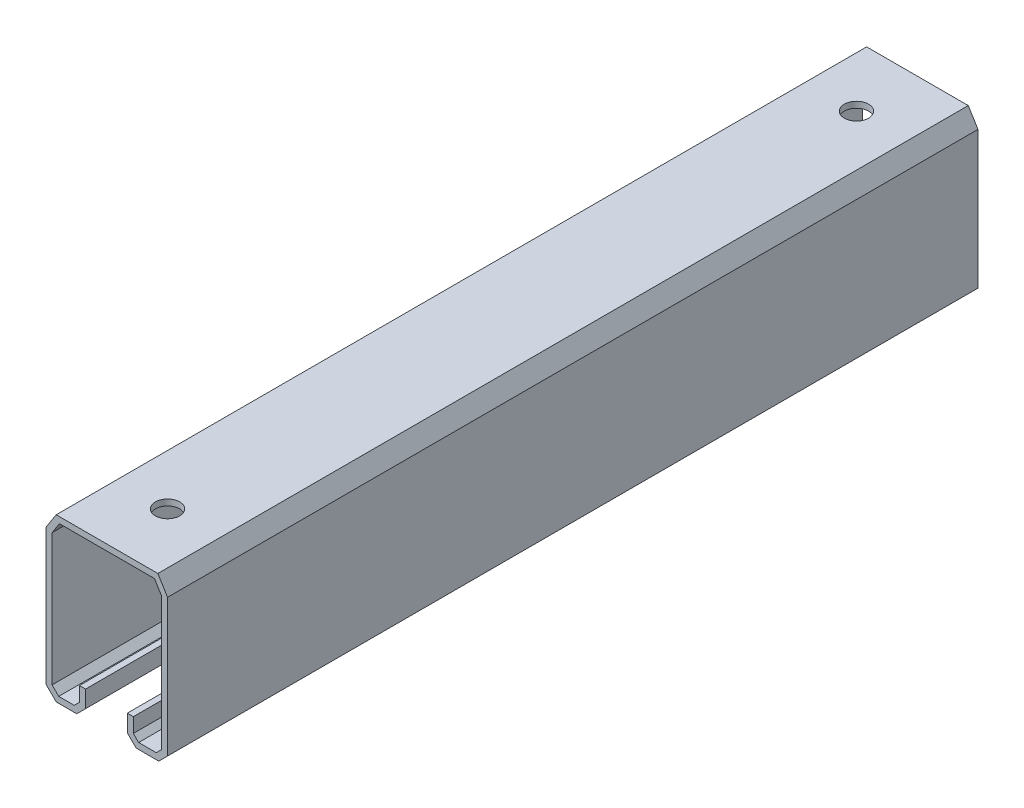
from build123d import *

# Parameters (mm, degrees)
SALIENTE_EXTRUIR1_DEPTH = 200
CROQUIS2_R              = 6
CORTAR_EXTRUIR1_DEPTH   = 400


with BuildPart() as part:
    # Croquis1 → Saliente-Extruir1 (new, symmetric)
    with BuildSketch(Plane.XY):
        Polygon((-10.469747898, -27.240151607), (-10.469747898, -35.650909673), (-14.818838224, -40), (-24.971054909, -40), (-30, -34.971054909), (-30, 32.215207139), (-24.971054909, 40), (25.20346735, 40), (30, 32.215207139), (30, -35.650909673), (25.650909673, -40), (14.472500162, -40), (10.123409835, -35.650909673), (10.123409835, -27.240151607), (13.123409835, -27.240151607), (13.123409835, -34.408268986), (15.715140849, -37), (24.408268986, -37), (27, -34.408268986), (27, 31.365191547), (23.528161609, 37), (-23.337516983, 37), (-27, 31.330486588), (-27, -33.728414222), (-23.728414222, -37), (-16.061478911, -37), (-13.469747898, -34.408268986), (-13.469747898, -27.240151607), align=None)
    extrude(amount=SALIENTE_EXTRUIR1_DEPTH, both=True)

    # Croquis2 → Cortar-Extruir1 (cut)
    with BuildSketch(Plane(origin=(0, 40, 0), x_dir=(1, 0, 0), z_dir=(0, 1, 0))):
        with Locations(Location((0, 170, 0), (0, 0, 270))):
            Circle(CROQUIS2_R)
        with Locations(Location((0, -170, 0), (0, 0, 270))):
            Circle(CROQUIS2_R)
    extrude(amount=-CORTAR_EXTRUIR1_DEPTH, mode=Mode.SUBTRACT)


solid = part.part
